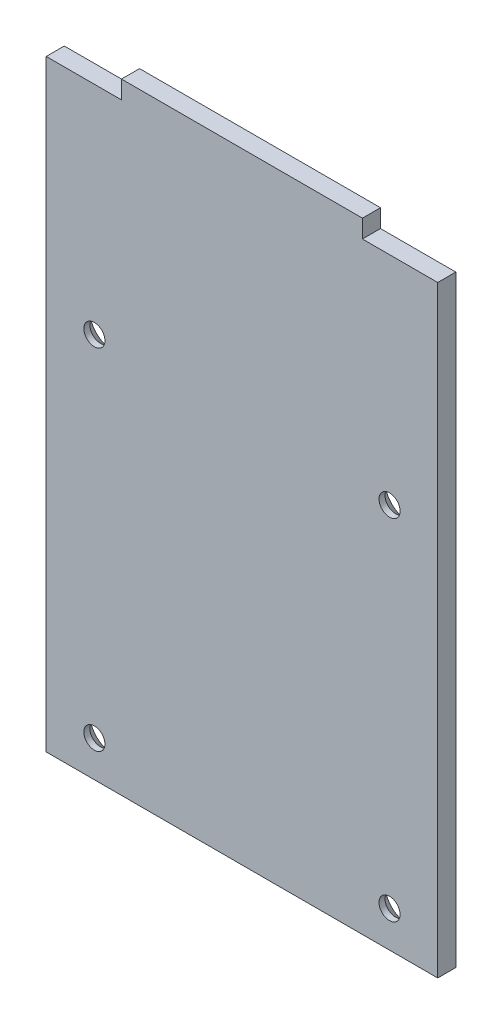
from build123d import *

# Parameters (mm, degrees)
SKETCH_1_W          = 40
SKETCH_1_H          = 3
EXTRUDE_1_DEPTH     = 3
SKETCH_2_R          = 1.75
CUT_EXTRUDE_1_DEPTH = 10
CHAMFER_1_SIZE      = 2


with BuildPart() as part:
    # Эскиз1 → Бобышка-Вытянуть1 (new body)
    with BuildSketch(Plane.XY):
        Polygon((-32.5, 50), (-32.5, -50), (32.5, -50), (32.5, 50), (20, 50), (20, 47), (-20, 47), (-20, 50), align=None)
        with Locations((0, 48.5)):
            Rectangle(SKETCH_1_W, SKETCH_1_H)
        with Locations((0, 51.5)):
            Rectangle(SKETCH_1_W, SKETCH_1_H)
    extrude(amount=EXTRUDE_1_DEPTH)

    # Эскиз2 → Вырез-Вытянуть1 (cut)
    with BuildSketch(Plane.XY.offset(3)):
        with Locations((-24.5, 14)):
            Circle(SKETCH_2_R)
        with Locations((24.5, 14)):
            Circle(SKETCH_2_R)
        with Locations((24.5, -44)):
            Circle(SKETCH_2_R)
        with Locations((-24.5, -44)):
            Circle(SKETCH_2_R)
    extrude(amount=-CUT_EXTRUDE_1_DEPTH, mode=Mode.SUBTRACT)

    # Фаска1
    chamfer_1_edges = [part.edges().sort_by_distance(p)[0] for p in [
        (-26.25, -44, 0),
        (22.75, -44, 0),
        (22.75, 14, 0),
        (-26.25, 14, 0),
    ]]
    chamfer(chamfer_1_edges, length=CHAMFER_1_SIZE)


solid = part.part
